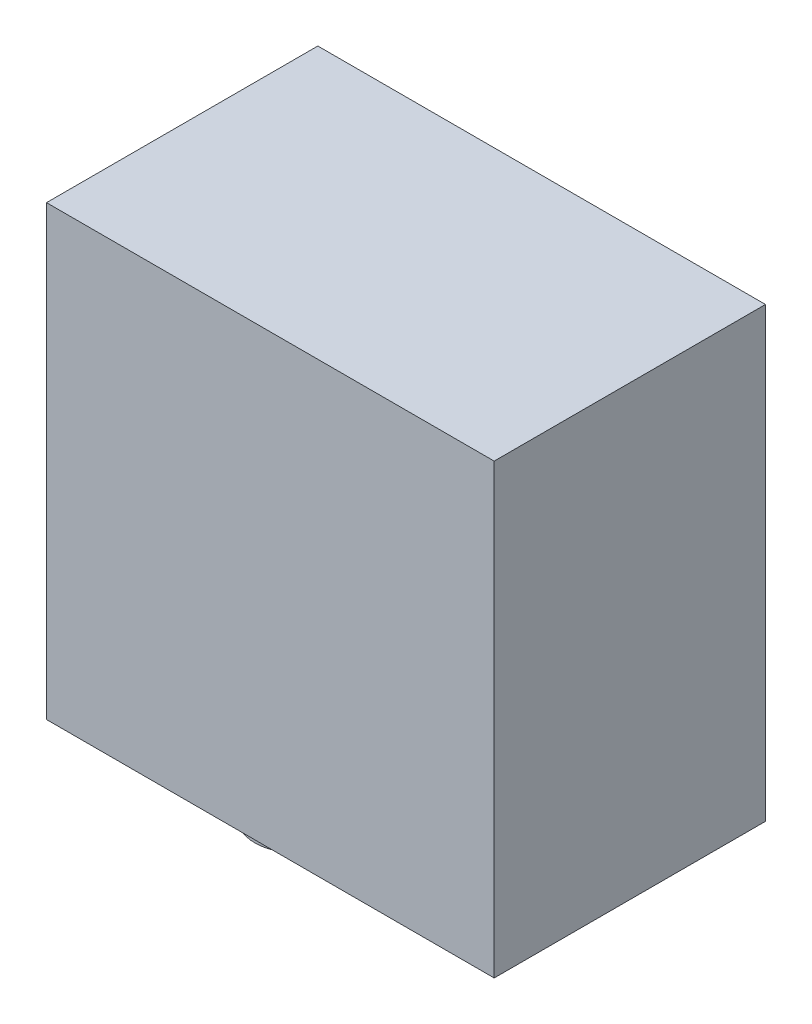
from build123d import *

# Parameters (mm, degrees)
SKETCH1_W           = 33
SKETCH1_H           = 33
BOSS_EXTRUDE1_DEPTH = 20
SKETCH2_R           = 3.018628297
BOSS_EXTRUDE2_DEPTH = 10


with BuildPart() as part:
    # Sketch1 → Boss-Extrude1 (new body)
    with BuildSketch(Plane.XY):
        Rectangle(SKETCH1_W, SKETCH1_H)
    extrude(amount=BOSS_EXTRUDE1_DEPTH)

    # Sketch2 → Boss-Extrude2 (add)
    with BuildSketch(Plane.XZ.offset(16.5)):
        with Locations(Location((-10.934193972, 7.179785009, 0), (0, 0, 90))):
            Circle(SKETCH2_R)
    extrude(amount=BOSS_EXTRUDE2_DEPTH)


solid = part.part
